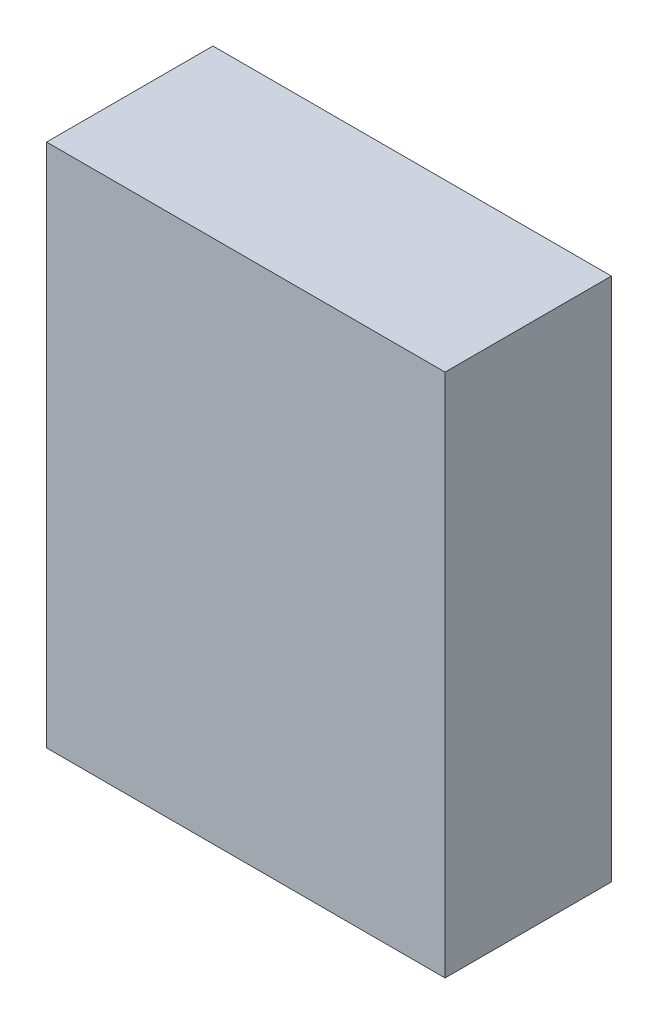
from build123d import *

# Parameters (mm, degrees)
SKETCH1_W      = 52.7
SKETCH1_H      = 69.4
ENVELOPE_DEPTH = 22


with BuildPart() as part:
    # Sketch1 → Envelope (new body)
    with BuildSketch(Plane.XY):
        Rectangle(SKETCH1_W, SKETCH1_H)
    extrude(amount=ENVELOPE_DEPTH)


solid = part.part
